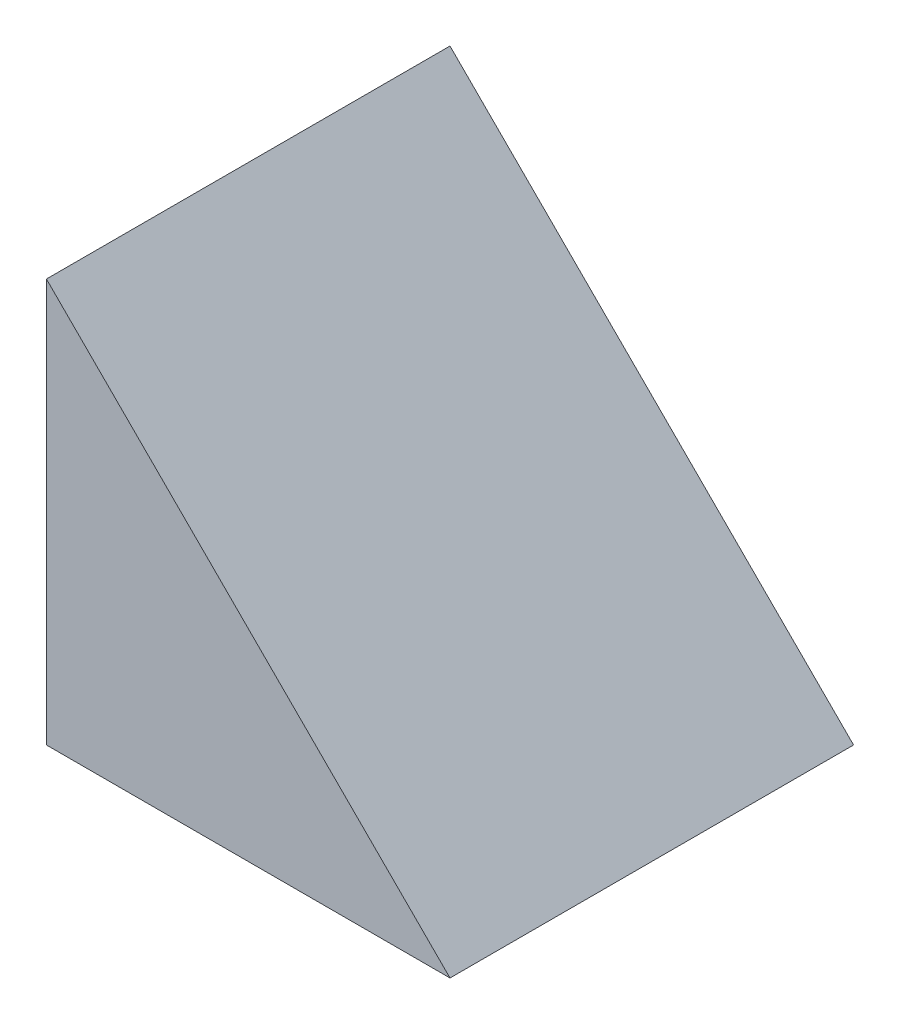
from build123d import *

# Parameters (mm, degrees)
EXTRUDE_1_DEPTH = 20


with BuildPart() as part:
    # 草图1 → 凸台-拉伸1 (new body)
    with BuildSketch(Plane.XY):
        Polygon((0, 0), (20, 0), (0, 20), align=None)
    extrude(amount=EXTRUDE_1_DEPTH)


solid = part.part
